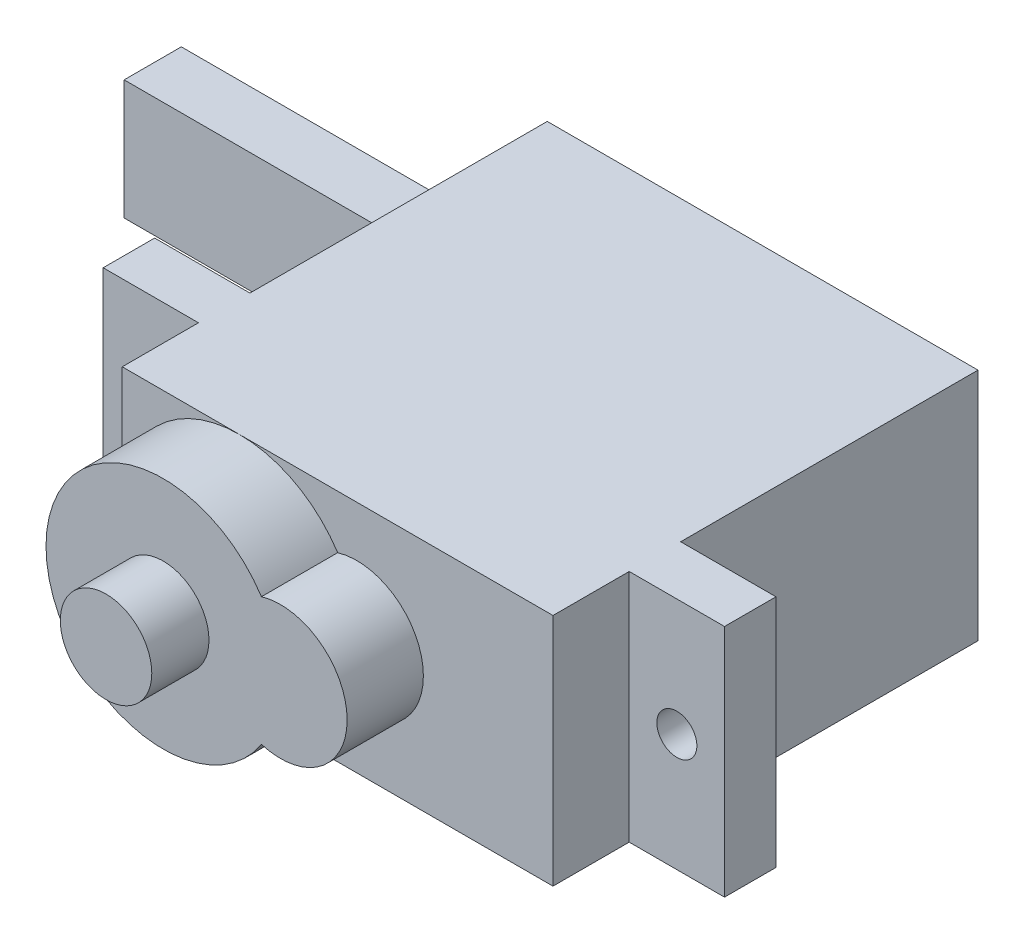
from build123d import *

# Parameters (mm, degrees)
ESQUISSE1_W             = 22.6
ESQUISSE1_H             = 12.3
BOSS_EXTRU_1_DEPTH      = 22.3
BOSS_EXTRU_2_DEPTH      = 5
BOSS_EXTRU_2_DEPTH_BACK = 27.6
ESQUISSE2_W             = 2.7
ESQUISSE2_H             = 12.3
ESQUISSE3_R             = 1.05
ENL_V_MAT_EXTRU_1_DEPTH = 5
BOSS_EXTRU_3_DEPTH      = 4
ESQUISSE5_R             = 2.4
BOSS_EXTRU_4_DEPTH      = 3
ESQUISSE6_W             = 3
ESQUISSE6_H             = 6.277768914
BOSS_EXTRU_5_DEPTH      = 16


with BuildPart() as part:
    # Esquisse1 → Boss.-Extru.1 (new body)
    with BuildSketch(Plane.XY):
        with Locations((11.3, 6.15)):
            Rectangle(ESQUISSE1_W, ESQUISSE1_H)
    extrude(amount=BOSS_EXTRU_1_DEPTH)

    # Esquisse2 → Boss.-Extru.2 (add, two sides: drawn at the far end of the back side and taken through both)
    with BuildSketch(Plane(origin=(22.6, 0, 0), x_dir=(0, 0, -1), z_dir=(1, 0, 0)).offset(-BOSS_EXTRU_2_DEPTH_BACK)):
        with Locations((-16.95, 6.15)):
            Rectangle(ESQUISSE2_W, ESQUISSE2_H)
    extrude(amount=BOSS_EXTRU_2_DEPTH + BOSS_EXTRU_2_DEPTH_BACK)

    # Esquisse3 → Enlèv. mat.-Extru.1 (cut)
    with BuildSketch(Plane.XY.offset(18.3)):
        with Locations((-2.5, 6.15)):
            Circle(ESQUISSE3_R)
        with Locations(Location((25.1, 6.15, 0), (0, 0, 90))):
            Circle(ESQUISSE3_R)
    extrude(amount=-ENL_V_MAT_EXTRU_1_DEPTH, mode=Mode.SUBTRACT)

    # Esquisse4 → Boss.-Extru.3 (add)
    with BuildSketch(Plane.XY.offset(22.3)):
        with BuildLine():
            ThreePointArc((11.304065041, 9.505311246), (0, 6.15), (11.304065041, 2.794688754))
            ThreePointArc((11.304065041, 2.794688754), (15.8, 6.15), (11.304065041, 9.505311246))
        make_face()
    extrude(amount=BOSS_EXTRU_3_DEPTH)

    # Esquisse5 → Boss.-Extru.4 (add)
    with BuildSketch(Plane.XY.offset(26.3)):
        with Locations((6.15, 6.15)):
            Circle(ESQUISSE5_R)
    extrude(amount=BOSS_EXTRU_4_DEPTH)

    # Esquisse6 → Boss.-Extru.5 (add)
    with BuildSketch(Plane.ZY):
        with Locations((4.7, 6.15)):
            Rectangle(ESQUISSE6_W, ESQUISSE6_H)
    extrude(amount=BOSS_EXTRU_5_DEPTH)


solid = part.part
